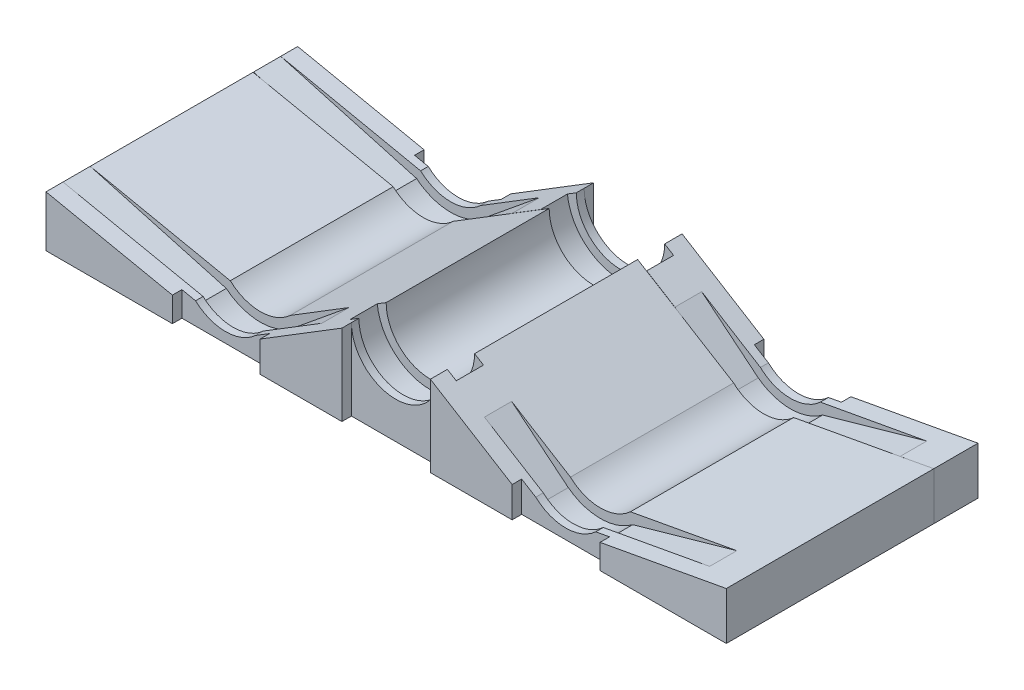
from build123d import *

# Parameters (mm, degrees)
SKETCH_1_W          = 100
SKETCH_1_H          = 4
EXTRUDE_1_DEPTH     = 15
EXTRUDE_1_2_DEPTH   = 15
CUT_EXTRUDE_1_DEPTH = 32
SKETCH_3_W          = 100
SKETCH_3_H          = 2.5
EXTRUDE_2_DEPTH     = 15
CUT_EXTRUDE_5_DEPTH = 37
SKETCH_5_W          = 13
SKETCH_5_H          = 11.9
CUT_EXTRUDE_6_DEPTH = 1.4
SKETCH_6_W          = 13
SKETCH_6_H          = 11.9
CUT_EXTRUDE_7_DEPTH = 1.4


with BuildPart() as part:
    # Эскиз1 → Бобышка-Вытянуть1 (new body)
    with BuildSketch(Plane(origin=(0, 72.101425994, 0), x_dir=(1, 0, 0), z_dir=(0, 1, 0))):
        with Locations((68.741769048, -100.552702475)):
            Rectangle(SKETCH_1_W, SKETCH_1_H)
    extrude(amount=EXTRUDE_1_DEPTH)


with BuildPart() as body_2:
    # Эскиз1 → Extrude 1 2 (new body)
    with BuildSketch(Plane(origin=(0, 72.101425994, 0), x_dir=(1, 0, 0), z_dir=(0, 1, 0))):
        with Locations((68.741769048, -72.552702475)):
            Rectangle(SKETCH_1_W, SKETCH_1_H)
    extrude(amount=EXTRUDE_1_2_DEPTH)


with BuildPart() as cut_extrude_1_tool:
    # Эскиз2 → Вырез-Вытянуть1 (new body)
    with BuildSketch(Plane.XY.offset(102.552702475)):
        with BuildLine():
            Line((18.741769048, 87.101425994), (18.741769048, 79.601425994))
            Line((18.741769048, 79.601425994), (38.7406223, 74.053793994))
            ThreePointArc((38.7406223, 74.053793994), (43.566960712, 72.257224124), (48.468541666, 73.837005729))
            Line((48.468541666, 73.837005729), (60.894137048, 84.001425994))
            ThreePointArc((60.894137048, 84.001425994), (68.741770048, 76.153792994), (76.589403048, 84.001425994))
            Line((76.589403048, 84.001425994), (89.014998431, 73.837005729))
            ThreePointArc((89.014998431, 73.837005729), (93.741770048, 72.25892129), (98.468541666, 73.837005729))
            Line((98.468541666, 73.837005729), (118.741769048, 79.601425994))
            Line((118.741769048, 79.601425994), (118.741769048, 87.101425994))
            Line((118.741769048, 87.101425994), (18.741769048, 87.101425994))
        make_face()
    extrude(amount=-CUT_EXTRUDE_1_DEPTH)


with BuildPart() as part_1:
    add(part.part)

    # Вырез-Вытянуть1: cut by cut_extrude_1_tool
    add(cut_extrude_1_tool.part, mode=Mode.SUBTRACT)



with BuildPart() as body_2_1:
    add(body_2.part)

    # Вырез-Вытянуть1: cut by cut_extrude_1_tool
    add(cut_extrude_1_tool.part, mode=Mode.SUBTRACT)


with BuildPart() as part_2:
    add(part_1.part)

    add(body_2_1.part)  # Бобышка-Вытянуть2 merges body 2
    # Эскиз3 → Бобышка-Вытянуть2 (add)
    with BuildSketch(Plane(origin=(0, 72.101425994, 0), x_dir=(1, 0, 0), z_dir=(0, 1, 0))):
        Polygon((18.741769048, -70.552702475), (18.741769048, -68.052702475), (118.741769048, -68.052702475), (118.741769048, -70.654560826), align=None)
        Polygon((18.741769048, -74.618981064), (18.741769048, -98.552702475), (118.741769048, -98.552702475), (118.741769048, -74.552702475), align=None)
        with Locations((68.741769048, -103.802702475)):
            Rectangle(SKETCH_3_W, SKETCH_3_H)
    extrude(amount=EXTRUDE_2_DEPTH)

    # Эскиз4 → Вырез-Вытянуть5 (cut)
    with BuildSketch(Plane.XY.offset(105.052702475)):
        with BuildLine():
            Line((18.741769048, 79.601425994), (39.329622083, 75.327825775))
            ThreePointArc((39.329622083, 75.327825775), (43.741770048, 73.601094828), (48.153918014, 75.327825775))
            Line((48.153918014, 75.327825775), (62.241769048, 84.001425994))
            ThreePointArc((62.241769048, 84.001425994), (68.741769048, 77.501425994), (75.241769048, 84.001425994))
            Line((75.241769048, 84.001425994), (89.330109389, 75.327825775))
            ThreePointArc((89.330109389, 75.327825775), (93.741769048, 73.601425994), (98.153428707, 75.327825775))
            Line((98.153428707, 75.327825775), (118.741769048, 79.101425994))
            Line((118.741769048, 79.101425994), (118.741769048, 87.101425994))
            Line((118.741769048, 87.101425994), (18.741769048, 87.101425994))
            Line((18.741769048, 87.101425994), (18.741769048, 79.601425994))
        make_face()
    extrude(amount=-CUT_EXTRUDE_5_DEPTH, mode=Mode.SUBTRACT)

    # Эскиз5 → Вырез-Вытянуть6 (cut)
    with BuildSketch(Plane.XY.offset(105.052702475)):
        with Locations((68.741769048, 78.051425994)):
            Rectangle(SKETCH_5_W, SKETCH_5_H)
        Polygon((100.187361471, 80.940674659), (87.265224484, 80.359547889), (87.265224484, 72.101425994), (100.187361471, 72.101425994), align=None)
        Polygon((50.218313612, 80.653123839), (37.321764311, 81.118057283), (37.321764311, 72.101425994), (50.218313612, 72.101425994), align=None)
    extrude(amount=-CUT_EXTRUDE_6_DEPTH, mode=Mode.SUBTRACT)

    # Эскиз6 → Вырез-Вытянуть7 (cut)
    with BuildSketch(Plane(origin=(0, 0, 68.052702475), x_dir=(-1, 0, 0), z_dir=(0, 0, -1))):
        Polygon((-100.057178334, 78.563373472), (-100.057178334, 72.101425994), (-87.265224484, 72.101425994), (-87.265224484, 80.653123839), align=None)
        with Locations((-68.741769048, 78.051425994)):
            Rectangle(SKETCH_6_W, SKETCH_6_H)
        Polygon((-50.05217336, 81.659885945), (-50.05217336, 72.101425994), (-37.321764311, 72.101425994), (-37.321764311, 81.118057283), align=None)
    extrude(amount=-CUT_EXTRUDE_7_DEPTH, mode=Mode.SUBTRACT)


solid = part_2.part
